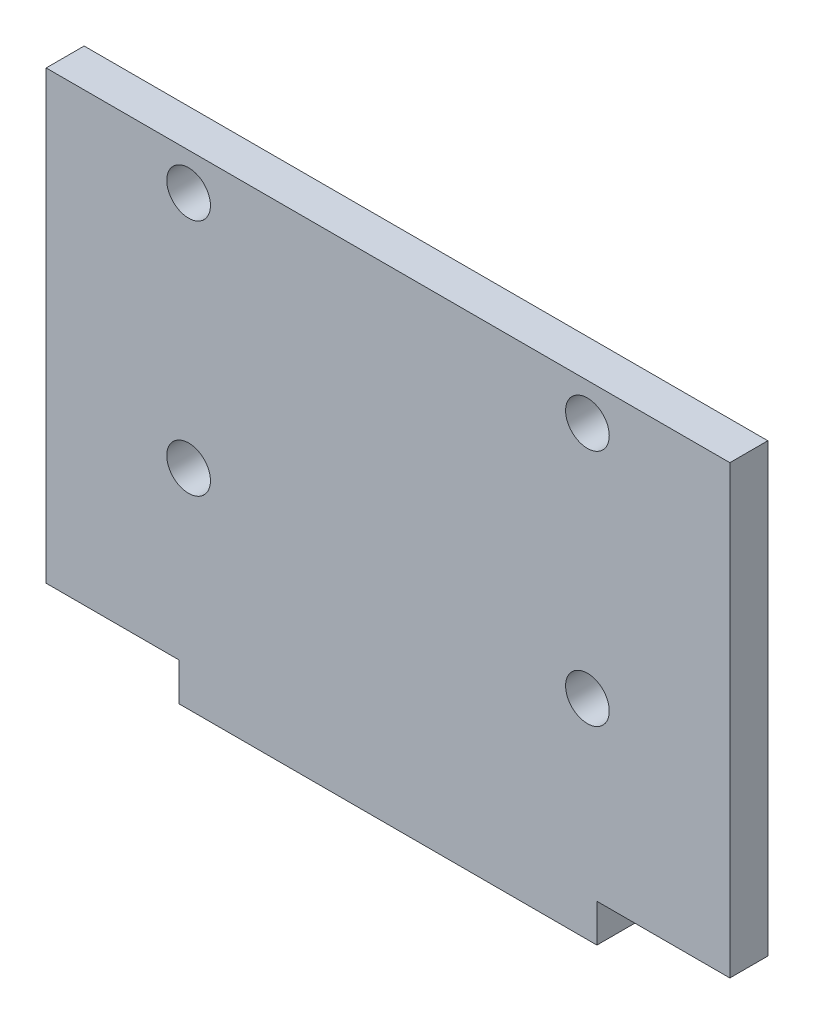
from build123d import *

# Parameters (mm, degrees)
SKETCH1_R           = 1.15
BOSS_EXTRUDE1_DEPTH = 2


with BuildPart() as part:
    # Sketch1 → Boss-Extrude1 (new body)
    with BuildSketch(Plane.XY):
        Polygon((-7, 2), (-7, 25.5), (29, 25.5), (29, 2), (22, 2), (22, 0), (0, 0), (0, 2), align=None)
        with Locations((0.5, 11)):
            Circle(SKETCH1_R, mode=Mode.SUBTRACT)
        with Locations((0.5, 23.55)):
            Circle(SKETCH1_R, mode=Mode.SUBTRACT)
        with Locations((21.5, 23.55)):
            Circle(SKETCH1_R, mode=Mode.SUBTRACT)
        with Locations((21.5, 11)):
            Circle(SKETCH1_R, mode=Mode.SUBTRACT)
    extrude(amount=BOSS_EXTRUDE1_DEPTH)


solid = part.part
